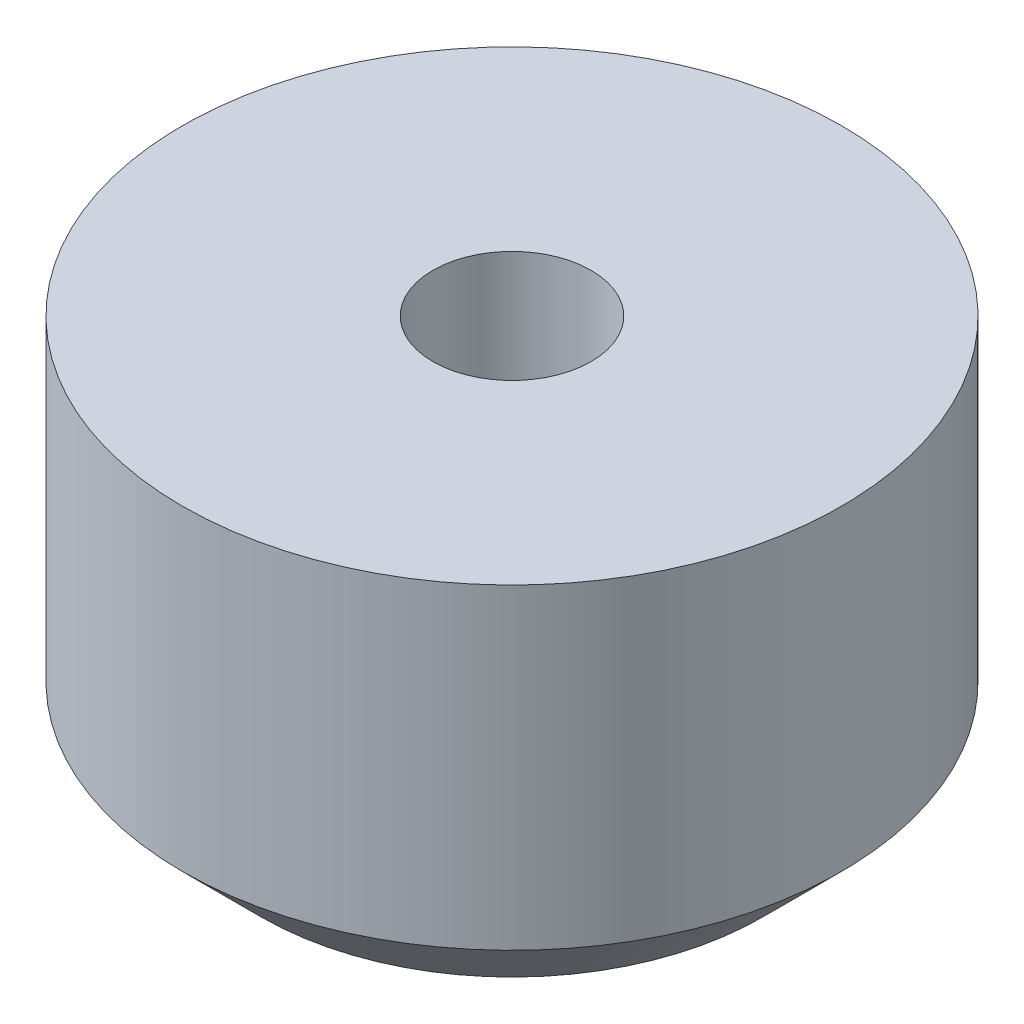
from build123d import *

# Parameters (mm, degrees)
SKETCH1_R           = 12.5
SKETCH1_R_2         = 3
BOSS_EXTRUDE1_DEPTH = 15
CHAMFER1_SIZE       = 3
SKETCH2_R           = 6
CUT_EXTRUDE1_DEPTH  = 5


with BuildPart() as part:
    # Sketch1 → Boss-Extrude1 (new body)
    with BuildSketch(Plane(origin=(0, 0, 0), x_dir=(1, 0, 0), z_dir=(0, 1, 0))):
        with Locations(Location((0, 0, 0), (0, 0, 270))):
            Circle(SKETCH1_R)
        with Locations(Location((0, 0, 0), (0, 0, 270))):
            Circle(SKETCH1_R_2, mode=Mode.SUBTRACT)
    extrude(amount=BOSS_EXTRUDE1_DEPTH)

    # Chamfer1
    chamfer1_edges = [part.edges().sort_by_distance(p)[0] for p in [
        (0, 0, -12.5),
    ]]
    chamfer(chamfer1_edges, length=CHAMFER1_SIZE)

    # Sketch2 → Cut-Extrude1 (cut)
    with BuildSketch(Plane.XZ):
        with Locations(Location((0, 0, 0), (0, 0, 270))):
            Circle(SKETCH2_R)
    extrude(amount=-CUT_EXTRUDE1_DEPTH, mode=Mode.SUBTRACT)


solid = part.part
